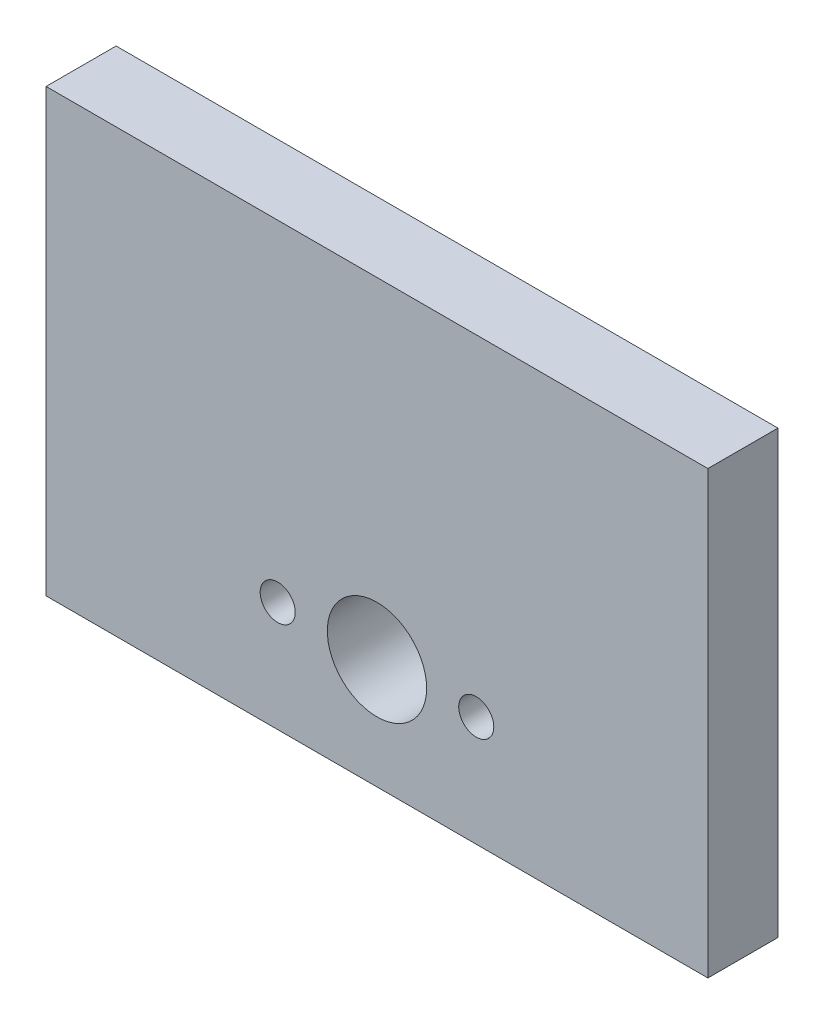
from build123d import *

# Parameters (mm, degrees)
SKETCH1_W           = 60
SKETCH1_H           = 40
SKETCH1_W_2         = 25
SKETCH1_H_2         = 15
SKETCH1_R           = 1.59
SKETCH1_R_2         = 4.5
BOSS_EXTRUDE1_DEPTH = 6.35


with BuildPart() as part:
    # Sketch1 → Boss-Extrude1 (new body)
    # profile 1 of 2: a face of its own
    with BuildSketch(Plane.XY):
        with Locations((30, -20)):
            Rectangle(SKETCH1_W, SKETCH1_H)
        with Locations((30, -30)):
            Rectangle(SKETCH1_W_2, SKETCH1_H_2, mode=Mode.SUBTRACT)
    # profile 2 of 2: a face of its own
    with BuildSketch(Plane.XY):
        with Locations((30, -30)):
            Rectangle(SKETCH1_W_2, SKETCH1_H_2)
        with Locations((39, -30)):
            Circle(SKETCH1_R, mode=Mode.SUBTRACT)
        with Locations((21, -30)):
            Circle(SKETCH1_R, mode=Mode.SUBTRACT)
        with Locations((30, -30)):
            Circle(SKETCH1_R_2, mode=Mode.SUBTRACT)
    extrude(amount=BOSS_EXTRUDE1_DEPTH)


solid = part.part
